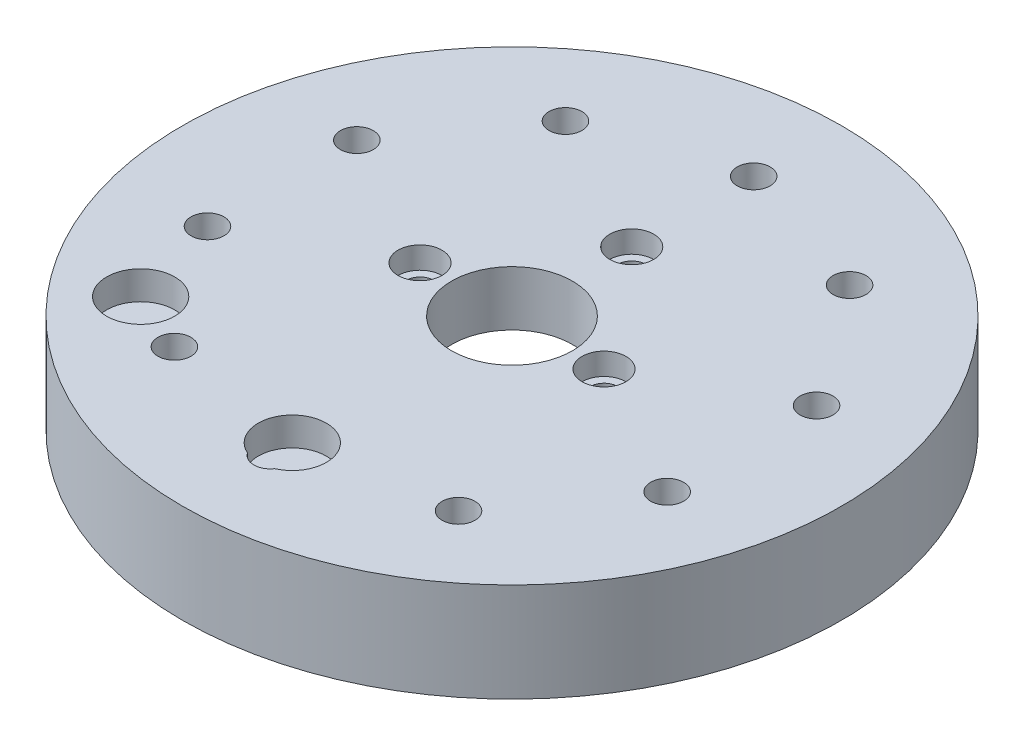
from build123d import *

# Parameters (mm, degrees)
SKETCH_1_R               = 30
SKETCH_1_R_2             = 1.25
SKETCH_1_R_3             = 5.5
EXTRUDE_1_DEPTH          = 5
CUT_EXTRUDE_START        = 5
SKETCH_1_15_R            = 2
CUT_EXTRUDE_2_DEPTH      = 2
SKETCH_2_R               = 3.1
CUT_EXTRUDE_3_DEPTH      = 2.6
EXTRUDE_START            = 4
SKETCH_3_R               = 30
SKETCH_3_R_2             = 14
EXTRUDE_2_DEPTH          = 4
SKETCH_4_R               = 1.5
CUT_EXTRUDE_4_DEPTH      = 44.370496884
SKETCH_4_3_R             = 2.25
CUT_EXTRUDE_5_DEPTH      = 6
PATTERN_CIRCULAR_1_COUNT = 10


with BuildPart() as part:
    # 草图1 → 凸台-拉伸1 (new body)
    with BuildSketch(Plane(origin=(0, 0, 0), x_dir=(1, 0, 0), z_dir=(0, 1, 0))):
        with Locations(Location((0, 0, 0), (0, 0, 270))):
            Circle(SKETCH_1_R)
        with Locations(Location((-8.375, 0, 0), (0, 0, 270))):
            Circle(SKETCH_1_R_2, mode=Mode.SUBTRACT)
        with Locations(Location((8.375, 0, 0), (0, 0, 270))):
            Circle(SKETCH_1_R_2, mode=Mode.SUBTRACT)
        with Locations(Location((0, 10.9, 0), (0, 0, 270))):
            Circle(SKETCH_1_R_2, mode=Mode.SUBTRACT)
        with Locations(Location((0, 0, 0), (0, 0, 270))):
            Circle(SKETCH_1_R_3, mode=Mode.SUBTRACT)
    extrude(amount=EXTRUDE_1_DEPTH)

    # 草图1<15> → 切除-拉伸2 (cut)
    with BuildSketch(Plane(origin=(0, 0, 0), x_dir=(1, 0, 0), z_dir=(0, 1, 0)).offset(CUT_EXTRUDE_START)):
        with Locations(Location((-8.375, 0, 0), (0, 0, 270))):
            Circle(SKETCH_1_15_R)
        with Locations(Location((8.375, 0, 0), (0, 0, 270))):
            Circle(SKETCH_1_15_R)
        with Locations(Location((0, 10.9, 0), (0, 0, 270))):
            Circle(SKETCH_1_15_R)
    extrude(amount=-CUT_EXTRUDE_2_DEPTH, mode=Mode.SUBTRACT)

    # 草图2 → 切除-拉伸3 (cut)
    with BuildSketch(Plane(origin=(0, 5, 0), x_dir=(1, 0, 0), z_dir=(0, 1, 0))):
        with Locations(Location((0, -20, 0), (0, 0, 270))):
            Circle(SKETCH_2_R)
        with Locations(Location((-18.428493563, -15.375, 0), (0, 0, 270))):
            Circle(SKETCH_2_R)
    extrude(amount=-CUT_EXTRUDE_3_DEPTH, mode=Mode.SUBTRACT)

    # 草图3 → 凸台-拉伸2 (add)
    with BuildSketch(Plane.XZ.offset(EXTRUDE_START)):
        with Locations(Location((0, 0, 0), (0, 0, 270))):
            Circle(SKETCH_3_R)
        with Locations(Location((0, 0, 0), (0, 0, 270))):
            Circle(SKETCH_3_R_2, mode=Mode.SUBTRACT)
    extrude(amount=-EXTRUDE_2_DEPTH)

    # 草图4 → 切除-拉伸4 (cut, through all)
    with BuildSketch(Plane.XZ.offset(4)):
        with Locations(Location((0, -22, 0), (0, 0, 270))):
            Circle(SKETCH_4_R)
    cut_extrude_4 = extrude(amount=-CUT_EXTRUDE_4_DEPTH, mode=Mode.SUBTRACT)

    # 草图4<3> → 切除-拉伸5 (cut)
    with BuildSketch(Plane.XZ.offset(4)):
        with Locations(Location((0, -22, 0), (0, 0, 270))):
            Circle(SKETCH_4_3_R)
    cut_extrude_5 = extrude(amount=-CUT_EXTRUDE_5_DEPTH, mode=Mode.SUBTRACT)

    # 阵列(圆周)1: 切除-拉伸4, 切除-拉伸5 ×10 about axis
    pattern_circular_1_axis = Axis((0, 0, 0), (0, 1, 0))
    add([cut_extrude_4.rotate(pattern_circular_1_axis, i * 360 / PATTERN_CIRCULAR_1_COUNT) for i in range(1, PATTERN_CIRCULAR_1_COUNT)], mode=Mode.SUBTRACT)
    add([cut_extrude_5.rotate(pattern_circular_1_axis, i * 360 / PATTERN_CIRCULAR_1_COUNT) for i in range(1, PATTERN_CIRCULAR_1_COUNT)], mode=Mode.SUBTRACT)


solid = part.part
